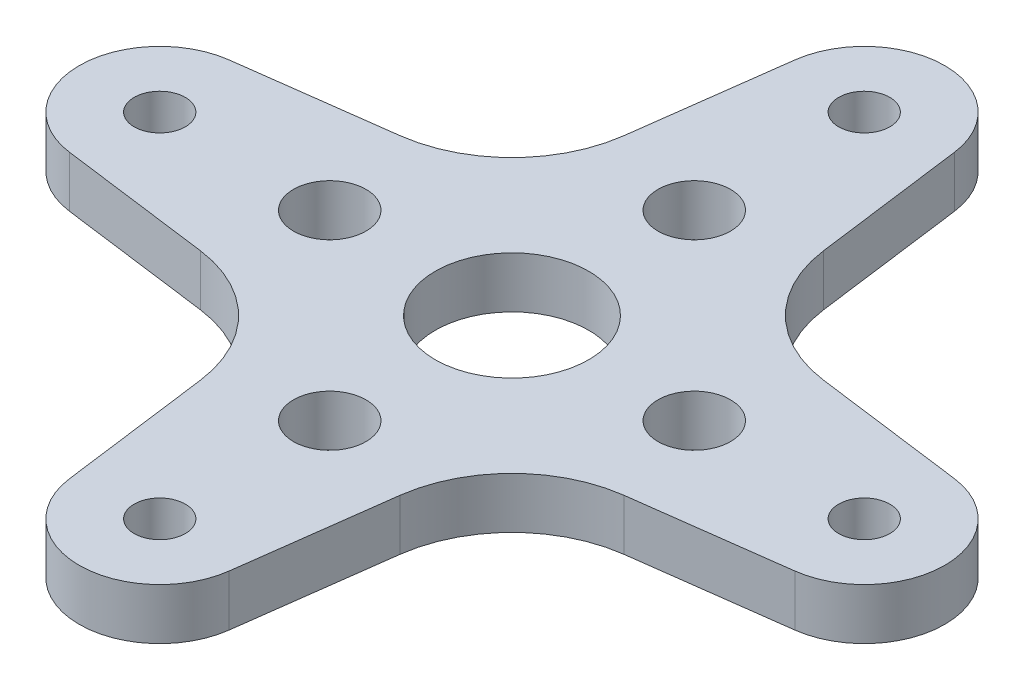
from build123d import *

# Parameters (mm, degrees)
BOSS_EXTRUDE1_DEPTH        = 3.175
F_1_8_0_1250_DOWEL_HOLE1_D = 3.175
SKETCH4_R                  = 4.7625
CUT_EXTRUDE1_DEPTH         = 39.125563171
M4_CLEARANCE_HOLE1_D       = 4.5


with BuildPart() as part:
    # Sketch1 → Boss-Extrude1 (new body)
    with BuildSketch(Plane(origin=(0, 0, 0), x_dir=(1, 0, 0), z_dir=(0, 1, 0))):
        with BuildLine():
            Line((4.957224307, 22.517830961), (6.192571563, 13.134436958))
            ThreePointArc((6.192571563, 13.134436958), (8.485281374, 8.485281374), (13.134436958, 6.192571563))
            Line((13.134436958, 6.192571563), (22.517830961, 4.957224307))
            ThreePointArc((22.517830961, 4.957224307), (26.8652, 0), (22.517830961, -4.957224307))
            Line((22.517830961, -4.957224307), (13.134436958, -6.192571563))
            ThreePointArc((13.134436958, -6.192571563), (10.620595205, -6.955137122), (8.485281374, -8.485281374))
            Line((8.485281374, -8.485281374), (-8.485281374, 8.485281374))
            ThreePointArc((-8.485281374, 8.485281374), (-6.955137122, 10.620595205), (-6.192571563, 13.134436958))
            Line((-6.192571563, 13.134436958), (-4.957224307, 22.517830961))
            ThreePointArc((-4.957224307, 22.517830961), (0, 26.8652), (4.957224307, 22.517830961))
        make_face()
    boss_extrude1 = extrude(amount=BOSS_EXTRUDE1_DEPTH)

    # Mirror7: Boss-Extrude1 across plane
    add(boss_extrude1.mirror(Plane(origin=(-8.485281374, 3.175, -8.485281374), x_dir=(0.7071067811865467, 0, 0.7071067811865483), z_dir=(0.7071067811865486, 0, -0.7071067811865466))))

    # 1/8 (0.1250) Dowel Hole1 (through all)
    with Locations(Plane(origin=(0, 3.175, 0), x_dir=(1, 0, 0), z_dir=(0, 1, 0))):
        with Locations((0, 21.8652), (0, -21.8652), (-21.8652, 0), (21.8652, 0)):
            Hole(F_1_8_0_1250_DOWEL_HOLE1_D / 2)

    # Sketch4 → Cut-Extrude1 (cut, through all)
    with BuildSketch(Plane(origin=(0, 3.175, 0), x_dir=(1, 0, 0), z_dir=(0, 1, 0))):
        with Locations(Location((0, 0, 0), (0, 0, 270))):
            Circle(SKETCH4_R)
    extrude(amount=-CUT_EXTRUDE1_DEPTH, mode=Mode.SUBTRACT)

    # M4 Clearance Hole1 (through all)
    with Locations(Plane(origin=(0, 3.175, 0), x_dir=(1, 0, 0), z_dir=(0, 1, 0))):
        with Locations((-11.313708499, 0), (0, 11.313708499), (11.313708499, 0), (0, -11.313708499)):
            Hole(M4_CLEARANCE_HOLE1_D / 2)


solid = part.part
